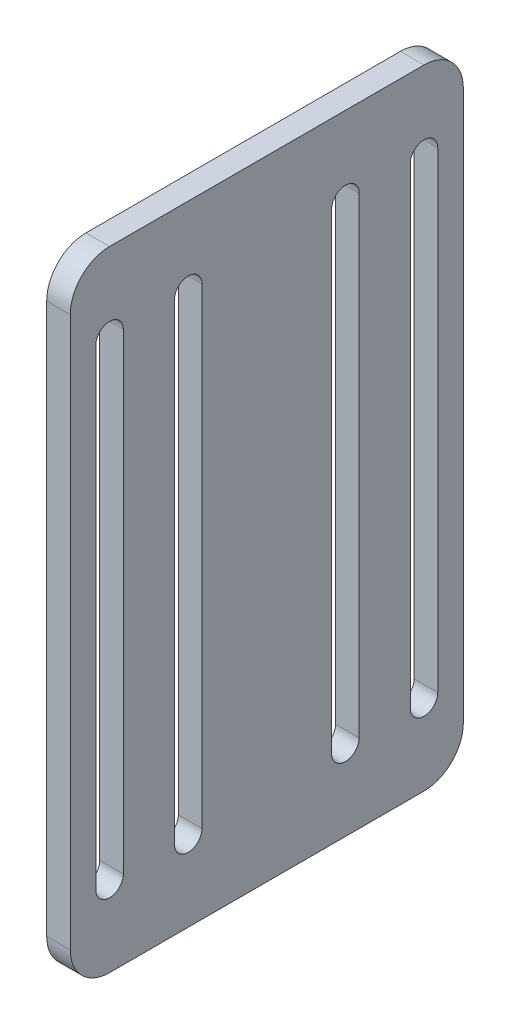
from build123d import *

# Parameters (mm, degrees)
SKETCH_1_W      = 50
SKETCH_1_H      = 80
SKETCH_1_R      = 1.75
EXTRUDE_1_DEPTH = 3
FILLET_1_R      = 5


with BuildPart() as part:
    # 草图1 → 凸台-拉伸1 (new body)
    # profile 1 of 4: a face of its own
    with BuildSketch(Plane(origin=(0, 0, 0), x_dir=(0, 0, -1), z_dir=(1, 0, 0))):
        Rectangle(SKETCH_1_W, SKETCH_1_H)
        with BuildLine():
            Line((-21.75, -30), (-21.75, 30))
            ThreePointArc((-21.75, 30), (-20, 31.75), (-18.25, 30))
            Line((-18.25, 30), (-18.25, -30))
            ThreePointArc((-18.25, -30), (-20, -31.75), (-21.75, -30))
        make_face(mode=Mode.SUBTRACT)
        with BuildLine():
            Line((-11.75, -30), (-11.75, 30))
            ThreePointArc((-11.75, 30), (-10, 31.75), (-8.25, 30))
            Line((-8.25, 30), (-8.25, -30))
            ThreePointArc((-8.25, -30), (-10, -31.75), (-11.75, -30))
        make_face(mode=Mode.SUBTRACT)
        with BuildLine():
            Line((-1.75, -30), (-1.75, 30))
            ThreePointArc((-1.75, 30), (0, 31.75), (1.75, 30))
            Line((1.75, 30), (1.75, -30))
            ThreePointArc((1.75, -30), (0, -31.75), (-1.75, -30))
        make_face(mode=Mode.SUBTRACT)
        with BuildLine():
            Line((8.25, -30), (8.25, 30))
            ThreePointArc((8.25, 30), (10, 31.75), (11.75, 30))
            Line((11.75, 30), (11.75, -30))
            ThreePointArc((11.75, -30), (10, -31.75), (8.25, -30))
        make_face(mode=Mode.SUBTRACT)
        with BuildLine():
            Line((21.75, 30), (21.75, -30))
            ThreePointArc((21.75, -30), (20, -31.75), (18.25, -30))
            Line((18.25, -30), (18.25, 30))
            ThreePointArc((18.25, 30), (20, 31.75), (21.75, 30))
        make_face(mode=Mode.SUBTRACT)
    # profile 2 of 4: a face of its own
    with BuildSketch(Plane(origin=(0, 0, 0), x_dir=(0, 0, -1), z_dir=(1, 0, 0))):
        with BuildLine():
            ThreePointArc((1.75, 30), (0, 28.25), (-1.75, 30))
            Line((-1.75, 30), (-1.75, -30))
            ThreePointArc((-1.75, -30), (0, -28.25), (1.75, -30))
            Line((1.75, -30), (1.75, 30))
        make_face()
    # profile 3 of 4: a face of its own
    with BuildSketch(Plane(origin=(0, 0, 0), x_dir=(0, 0, -1), z_dir=(1, 0, 0))):
        with Locations((0, 30)):
            Circle(SKETCH_1_R)
    # profile 4 of 4: a face of its own
    with BuildSketch(Plane(origin=(0, 0, 0), x_dir=(0, 0, -1), z_dir=(1, 0, 0))):
        with Locations((0, -30)):
            Circle(SKETCH_1_R)
    extrude(amount=EXTRUDE_1_DEPTH)

    # 圆角1
    fillet_1_edges = [part.edges().sort_by_distance(p)[0] for p in [
        (1.5, -40, -25),
        (1.5, -40, 25),
        (1.5, 40, 25),
        (1.5, 40, -25),
    ]]
    fillet(fillet_1_edges, radius=FILLET_1_R)


solid = part.part
